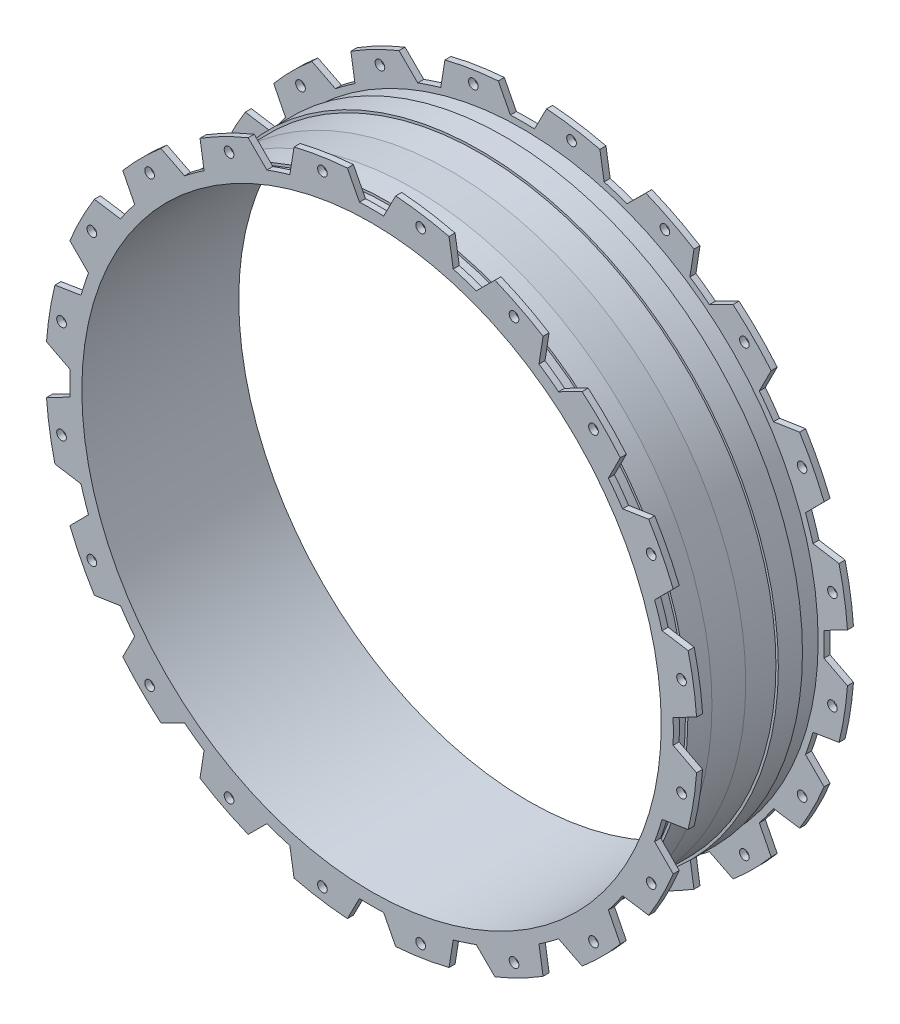
from build123d import *

# Parameters (mm, degrees)
CUT_EXTRUDE1_DEPTH = 404.360880602
CIRPATTERN1_COUNT  = 20
SKETCH3_R          = 4
CUT_EXTRUDE2_DEPTH = 403.367990775
CIRPATTERN2_COUNT  = 20


with BuildPart() as part:
    # Sketch1 → Revolve1 (revolve)
    with BuildSketch(Plane(origin=(0, 0, 0), x_dir=(0, 0, -1), z_dir=(1, 0, 0)), mode=Mode.PRIVATE) as revolve1_sk:
        Polygon((65, 240), (65, 270), (60, 270), (60, 245), (45, 245), (45, 247), (25, 247), (25, 245), (0, 245), (-30, 247), (-50, 247), (-50, 245), (-60, 245), (-60, 270), (-65, 270), (-65, 240), align=None)
    revolve(revolve1_sk.sketch.rotate(Axis((0, 0, 71.09375), (0, 0, -1)), 90), axis=Axis((0, 0, 71.09375), (0, 0, -1)))

    # Sketch2 → Cut-Extrude1 (cut, through all)
    with BuildSketch(Plane.XY.offset(65)):
        with BuildLine():
            Line((10, 249.799919936), (20, 269.258240357))
            ThreePointArc((20, 269.258240357), (0, 270), (-20, 269.258240357))
            Line((-20, 269.258240357), (-10, 249.799919936))
            ThreePointArc((-10, 249.799919936), (0, 250), (10, 249.799919936))
        make_face()
    cut_extrude1 = extrude(amount=-CUT_EXTRUDE1_DEPTH, mode=Mode.SUBTRACT)

    # CirPattern1: Cut-Extrude1 ×20 about axis
    cirpattern1_axis = Axis((0, 0, 0), (0, 0, 1))
    for i in range(1, CIRPATTERN1_COUNT):
        add(cut_extrude1.rotate(cirpattern1_axis, i * 360 / CIRPATTERN1_COUNT), mode=Mode.SUBTRACT)

    # Sketch3 → Cut-Extrude2 (cut, through all)
    with BuildSketch(Plane.XY.offset(65)):
        with Locations((40.67296091, 256.798968555)):
            Circle(SKETCH3_R)
    cut_extrude2 = extrude(amount=-CUT_EXTRUDE2_DEPTH, mode=Mode.SUBTRACT)

    # CirPattern2: Cut-Extrude2 ×20 about axis
    cirpattern2_axis = Axis((0, 0, 0), (0, 0, 1))
    for i in range(1, CIRPATTERN2_COUNT):
        add(cut_extrude2.rotate(cirpattern2_axis, i * 360 / CIRPATTERN2_COUNT), mode=Mode.SUBTRACT)


solid = part.part
